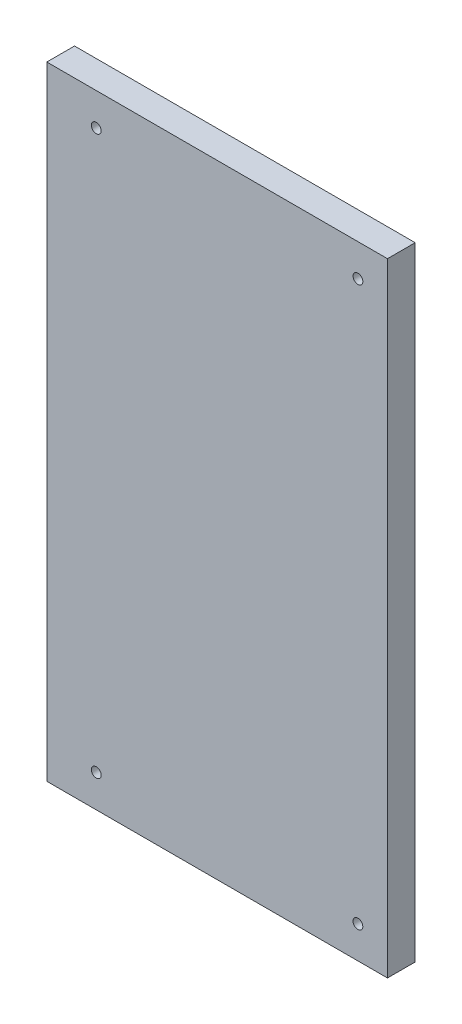
from build123d import *

# Parameters (mm, degrees)
SKETCH1_W           = 234.176429215
SKETCH1_H           = 428.225
BOSS_EXTRUDE1_DEPTH = 19.05
SKETCH4_R           = 3.3655
CUT_EXTRUDE2_DEPTH  = 275.417913121
SKETCH5_R           = 3.3782
CUT_EXTRUDE3_DEPTH  = 275.68979061


with BuildPart() as part:
    # Sketch1 → Boss-Extrude1 (new body)
    with BuildSketch(Plane.XY):
        with Locations((-269.476437964, 203)):
            Rectangle(SKETCH1_W, SKETCH1_H)
    extrude(amount=BOSS_EXTRUDE1_DEPTH)

    # Sketch4 → Cut-Extrude2 (cut, through all)
    with BuildSketch(Plane(origin=(-216.206452416, 203, -1.905), x_dir=(0, -1, 0), z_dir=(0, 0, -1))):
        with Locations(Location((192.0145, -43.49822906, 0), (0, 0, 90))):
            Circle(SKETCH4_R)
    cut_extrude2 = extrude(amount=-CUT_EXTRUDE2_DEPTH, mode=Mode.SUBTRACT)

    # Sketch5 → Cut-Extrude3 (cut, through all)
    with BuildSketch(Plane(origin=(-216.206452416, 203, -5.207), x_dir=(0, -1, 0), z_dir=(0, 0, -1))):
        with Locations(Location((191.807308052, 136.376108523, 0), (0, 0, 90))):
            Circle(SKETCH5_R)
    cut_extrude3 = extrude(amount=-CUT_EXTRUDE3_DEPTH, mode=Mode.SUBTRACT)

    # Mirror1: Cut-Extrude2, Cut-Extrude3 across plane
    add(cut_extrude2.mirror(Plane.ZX.offset(203)), mode=Mode.SUBTRACT)
    add(cut_extrude3.mirror(Plane.ZX.offset(203)), mode=Mode.SUBTRACT)


solid = part.part
